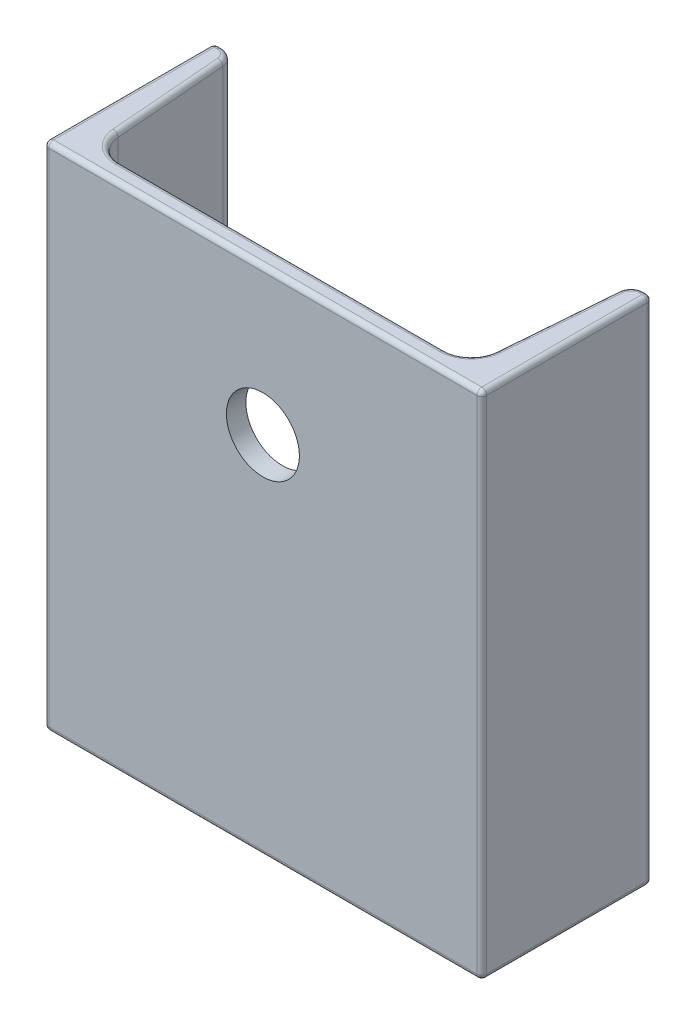
from build123d import *

# Parameters (mm, degrees)
UPN_UPN180_1_DEPTH = 210
SKETCH17_R         = 15
CUT_EXTRUDE1_DEPTH = 10
FILLET1_R          = 2


with BuildPart() as part:
    # Sketch110 → Upn UPN180(1) (new body)
    with BuildSketch(Plane(origin=(0, 186.578947368, 0), x_dir=(0, 0, -1), z_dir=(0, -1, 0))):
        with BuildLine():
            Line((70, 180), (0, 180))
            Line((0, 180), (0, 0))
            Line((0, 0), (70, 0))
            Line((70, 0), (70, 3.122386663))
            ThreePointArc((70, 3.122386663), (68.541183887, 6.853181859), (64.938606257, 8.604870092))
            Line((64.938606257, 8.604870092), (18.122787486, 12.350200343))
            ThreePointArc((18.122787486, 12.350200343), (10.917632226, 15.85357681), (8, 23.315167202))
            Line((8, 23.315167202), (8, 156.684832798))
            ThreePointArc((8, 156.684832798), (10.917632226, 164.14642319), (18.122787486, 167.649799657))
            Line((18.122787486, 167.649799657), (64.938606257, 171.395129908))
            ThreePointArc((64.938606257, 171.395129908), (68.541183887, 173.146818141), (70, 176.877613337))
            Line((70, 176.877613337), (70, 180))
        make_face()
    extrude(amount=UPN_UPN180_1_DEPTH)

    # Sketch17 → Cut-Extrude1 (cut)
    with BuildSketch(Plane(origin=(0, 0, -8), x_dir=(-1, 0, 0), z_dir=(0, 0, -1))):
        with Locations((-90, 126.578947368)):
            Circle(SKETCH17_R)
    extrude(amount=-CUT_EXTRUDE1_DEPTH, mode=Mode.SUBTRACT)

    # Fillet1
    fillet1_edges = [part.edges().sort_by_distance(p)[0] for p in [
        (169.522464782, 186.578947368, -41.530696872),
        (164.14642319, 186.578947368, -10.917632226),
        (180, -23.421052632, -35),
        (90, 186.578947368, -8),
        (15.85357681, 186.578947368, -10.917632226),
        (10.477535218, 186.578947368, -41.530696872),
        (6.853181859, 186.578947368, -68.541183887),
        (1.561193332, 186.578947368, -70),
        (0, 186.578947368, -35),
        (90, 186.578947368, 0),
        (180, 186.578947368, -35),
        (178.438806668, 186.578947368, -70),
        (173.146818141, 186.578947368, -68.541183887),
        (90, -23.421052632, 0),
        (0, -23.421052632, -35),
        (0, 81.578947368, -70),
        (0, 81.578947368, 0),
        (180, 81.578947368, 0),
        (180, 81.578947368, -70),
        (1.561193332, -23.421052632, -70),
        (6.853181859, -23.421052632, -68.541183887),
        (10.477535218, -23.421052632, -41.530696872),
        (15.85357681, -23.421052632, -10.917632226),
        (90, -23.421052632, -8),
        (164.14642319, -23.421052632, -10.917632226),
        (169.522464782, -23.421052632, -41.530696872),
        (173.146818141, -23.421052632, -68.541183887),
        (178.438806668, -23.421052632, -70),
    ]]
    fillet(fillet1_edges, radius=FILLET1_R)


solid = part.part
